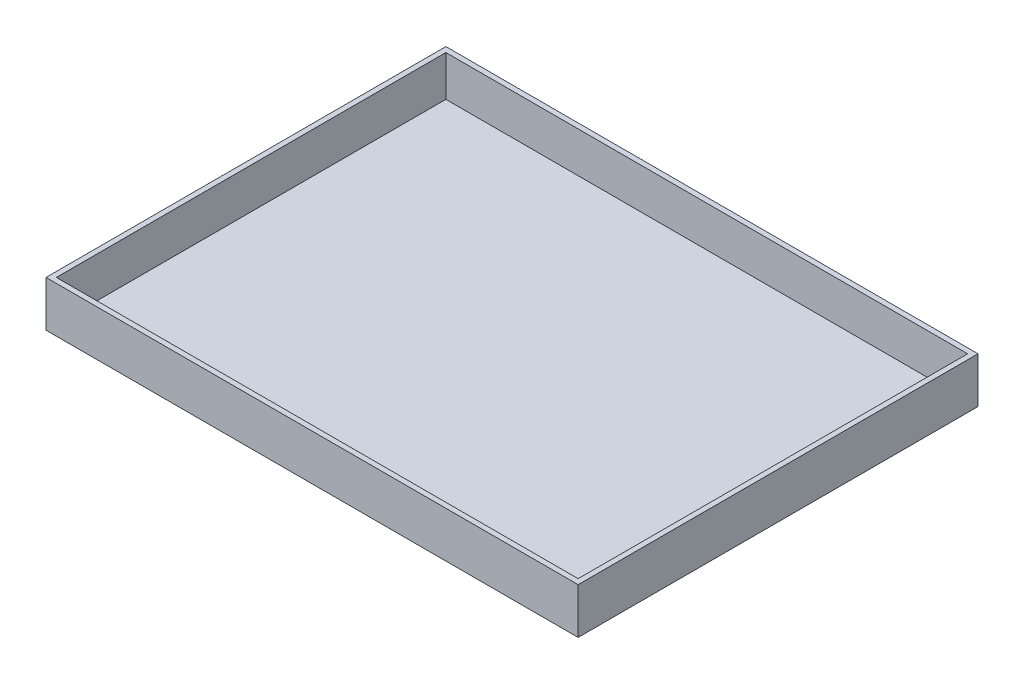
from build123d import *

# Parameters (mm, degrees)
SKETCH1_W           = 2615
SKETCH1_H           = 1965
BOSS_EXTRUDE1_DEPTH = 260
SHELL1_T            = 25.4
SKETCH2_W           = 2615
SKETCH2_H           = 1965
CUT_EXTRUDE1_DEPTH  = 35.306


with BuildPart() as part:
    # Sketch1 → Boss-Extrude1 (new body)
    with BuildSketch(Plane(origin=(0, 0, 0), x_dir=(1, 0, 0), z_dir=(0, 1, 0))):
        Rectangle(SKETCH1_W, SKETCH1_H)
    extrude(amount=BOSS_EXTRUDE1_DEPTH)

    # Shell1 (no face opened: a closed hollow body)
    add(offset(amount=-SHELL1_T, mode=Mode.PRIVATE), mode=Mode.SUBTRACT)

    # Sketch2 → Cut-Extrude1 (cut)
    with BuildSketch(Plane(origin=(0, 260, 0), x_dir=(1, 0, 0), z_dir=(0, 1, 0))):
        Rectangle(SKETCH2_W, SKETCH2_H)
    extrude(amount=-CUT_EXTRUDE1_DEPTH, mode=Mode.SUBTRACT)


solid = part.part
